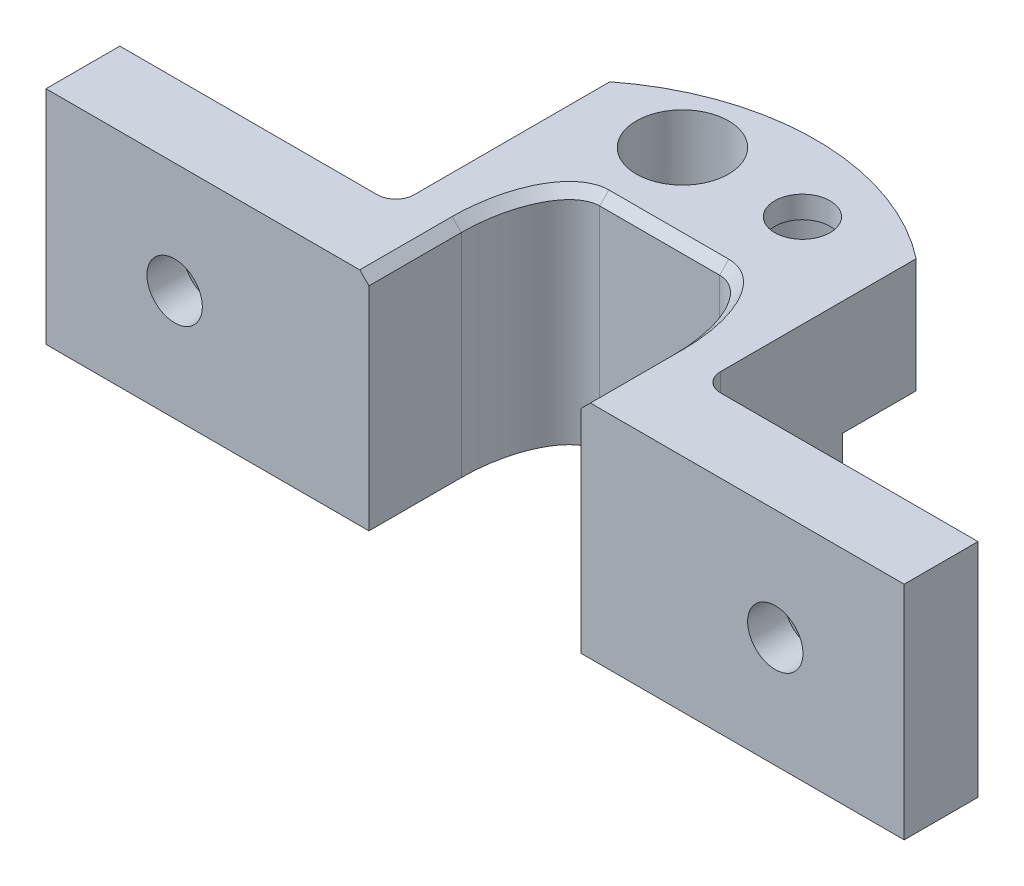
from build123d import *

# Parameters (mm, degrees)
BOSS_EXTRUDE1_DEPTH = 12
CUT_EXTRUDE1_DEPTH  = 2
SKETCH3_R           = 2.5
SKETCH3_R_2         = 1.5
BOSS_EXTRUDE2_DEPTH = 1.2
SKETCH4_R           = 2.5
BOSS_EXTRUDE3_DEPTH = 5
CHAMFER1_SIZE       = 0.5
SKETCH5_R           = 1.5
CUT_EXTRUDE2_DEPTH  = 5


with BuildPart() as part:
    # Sketch1 → Boss-Extrude1 (new body)
    with BuildSketch(Plane(origin=(0, 0, 0), x_dir=(1, 0, 0), z_dir=(0, 1, 0))):
        with BuildLine():
            Line((-23.25, -5), (-5.749755012, -5))
            Line((-5.749755012, -5), (-5.749755012, 0))
            add(Edge.make_bspline(
                [(-3.25, 5), (-5.749755012, 5), (-5.749755012, 0)],
                knots=[0, 0, 0, 1.570796327, 1.570796327, 1.570796327], degree=2, weights=[1, 0.707106781, 1]))
            Line((-3.25, 5), (3.25, 5))
            add(Edge.make_bspline(
                [(5.748694825, 0), (5.748694825, 5), (3.25, 5)],
                knots=[4.71238898, 4.71238898, 4.71238898, 6.283185307, 6.283185307, 6.283185307], degree=2, weights=[1, 0.707106781, 1]))
            Line((5.748694825, 0), (5.748694825, -5))
            Line((5.748694825, -5), (23.25, -5))
            Line((23.25, -5), (23.25, -3))
            Line((23.25, -3), (23.25, -1))
            Line((23.25, -1), (9.3, -1))
            ThreePointArc((9.3, -1), (8.592893219, -0.707106781), (8.3, 0))
            Line((8.3, 0), (8.3, 6.6))
            Line((8.3, 6.6), (-8.3, 6.6))
            Line((-8.3, 6.6), (-8.3, 0))
            ThreePointArc((-8.3, 0), (-8.592893219, -0.707106781), (-9.3, -1))
            Line((-9.3, -1), (-23.25, -1))
            Line((-23.25, -1), (-23.25, -5))
        make_face()
    extrude(amount=BOSS_EXTRUDE1_DEPTH)

    # Sketch2 → Cut-Extrude1 (cut)
    with BuildSketch(Plane(origin=(0, 0, 1), x_dir=(-1, 0, 0), z_dir=(0, 0, -1))):
        Polygon((19.85850269, 6), (18.068716856, 9.1), (14.489145187, 9.1), (12.699359352, 6), (14.489145187, 2.9), (18.068716856, 2.9), align=None)
        Polygon((-12.686507152, 6), (-14.476292987, 9.1), (-18.055864656, 9.1), (-19.84565049, 6), (-18.055864656, 2.9), (-14.476292987, 2.9), align=None)
    extrude(amount=-CUT_EXTRUDE1_DEPTH, mode=Mode.SUBTRACT)

    # Sketch3 → Boss-Extrude2 (add)
    with BuildSketch(Plane(origin=(0, 12, 0), x_dir=(1, 0, 0), z_dir=(0, 1, 0))):
        with BuildLine():
            Line((-8.3, 6.6), (8.3, 6.6))
            Line((8.3, 6.6), (8.3, 10.6))
            ThreePointArc((8.3, 10.6), (0, 13.462912018), (-8.3, 10.6))
            Line((-8.3, 10.6), (-8.3, 6.6))
        make_face()
        with Locations(Location((-3.25, 9.48526903, 0), (0, 0, 270))):
            Circle(SKETCH3_R, mode=Mode.SUBTRACT)
        with Locations(Location((3.25, 9.48526903, 0), (0, 0, 270))):
            Circle(SKETCH3_R_2, mode=Mode.SUBTRACT)
    extrude(amount=-BOSS_EXTRUDE2_DEPTH)

    # Sketch4 → Boss-Extrude3 (add)
    with BuildSketch(Plane.XZ.offset(-10.8)):
        with BuildLine():
            Line((8.3, -6.6), (-8.3, -6.6))
            Line((-8.3, -6.6), (-8.3, -10.6))
            ThreePointArc((-8.3, -10.6), (0, -13.462912018), (8.3, -10.6))
            Line((8.3, -10.6), (8.3, -6.6))
        make_face()
        with Locations(Location((-3.25, -9.48526903, 0), (0, 0, 90))):
            Circle(SKETCH4_R, mode=Mode.SUBTRACT)
        with Locations(Location((3.25, -9.48526903, 0), (0, 0, 270))):
            Circle(SKETCH4_R, mode=Mode.SUBTRACT)
    extrude(amount=BOSS_EXTRUDE3_DEPTH)

    # Chamfer1
    chamfer1_edges = [part.edges().sort_by_distance(p)[0] for p in [
        (0, 12, -5),
        (-5.260112096, 12, -2.972310439),
        (5.259369228, 12, -2.972013605),
        (-5.749755012, 12, 2.5),
        (5.748694825, 12, 2.5),
    ]]
    chamfer(chamfer1_edges, length=CHAMFER1_SIZE)

    # Sketch5 → Cut-Extrude2 (cut)
    with BuildSketch(Plane(origin=(0, 0, 1), x_dir=(-1, 0, 0), z_dir=(0, 0, -1))):
        with Locations((-16.266078821, 6)):
            Circle(SKETCH5_R)
        with Locations((16.278931021, 6)):
            Circle(SKETCH5_R)
    extrude(amount=-CUT_EXTRUDE2_DEPTH, mode=Mode.SUBTRACT)


solid = part.part
